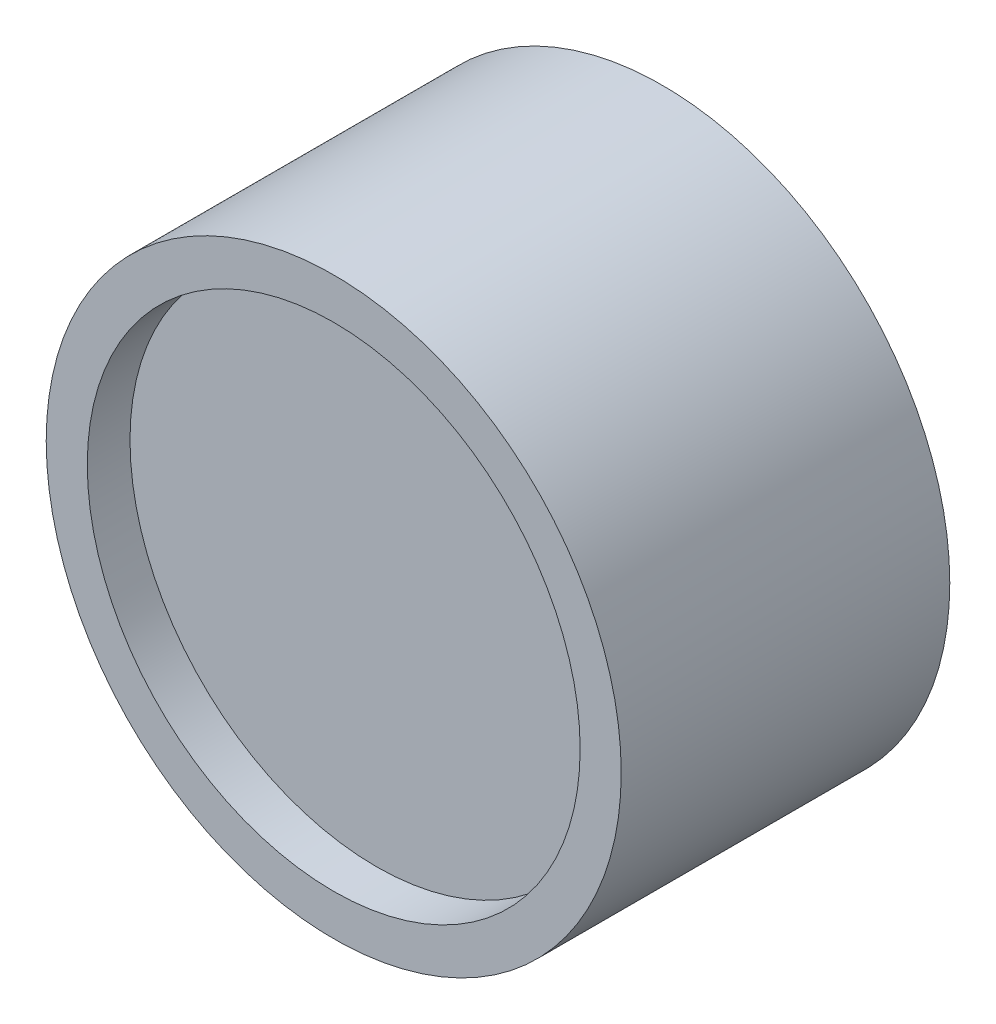
from build123d import *

# Parameters (mm, degrees)
SKETCH1_R                        = 22.225
BOSS_EXTRUDE1_DEPTH              = 25.4
SKETCH2_R                        = 19.05
CUT_EXTRUDE1_DEPTH               = 3.302
CUT_EXTRUDE2_START               = -3.302
SKETCH3_R                        = 19.05
CUT_EXTRUDE2_DEPTH               = 3.302
F_3_8_0_125_DIAMETER_HOLE1_D     = 3.175
F_3_8_0_125_DIAMETER_HOLE1_DEPTH = 16.002
F_3_8_0_125_DIAMETER_HOLE1_TIP   = 0.953866233


with BuildPart() as part:
    # Sketch1 → Boss-Extrude1 (new body)
    with BuildSketch(Plane.XY):
        Circle(SKETCH1_R)
    extrude(amount=BOSS_EXTRUDE1_DEPTH)

    # Sketch2 → Cut-Extrude1 (cut)
    with BuildSketch(Plane.XY.offset(25.4)):
        Circle(SKETCH2_R)
    extrude(amount=-CUT_EXTRUDE1_DEPTH, mode=Mode.SUBTRACT)

    # Sketch3 → Cut-Extrude2 (cut)
    with BuildSketch(Plane(origin=(0, 0, 0), x_dir=(-1, 0, 0), z_dir=(0, 0, -1)).offset(CUT_EXTRUDE2_START)):
        with Locations(Location((0, 0, 0), (0, 0, 180))):
            Circle(SKETCH3_R)
    extrude(amount=CUT_EXTRUDE2_DEPTH, mode=Mode.SUBTRACT)

    # 3/8 (0.125) Diameter Hole1
    with Locations(Plane.XZ.offset(22.225)):
        with Locations((0, 12.7)):
            Hole(F_3_8_0_125_DIAMETER_HOLE1_D / 2, depth=F_3_8_0_125_DIAMETER_HOLE1_DEPTH)
            with Locations((0, 0, -(F_3_8_0_125_DIAMETER_HOLE1_DEPTH + F_3_8_0_125_DIAMETER_HOLE1_TIP / 2))):  # 118° drill point
                Cone(0, F_3_8_0_125_DIAMETER_HOLE1_D / 2, F_3_8_0_125_DIAMETER_HOLE1_TIP, mode=Mode.SUBTRACT)


solid = part.part
